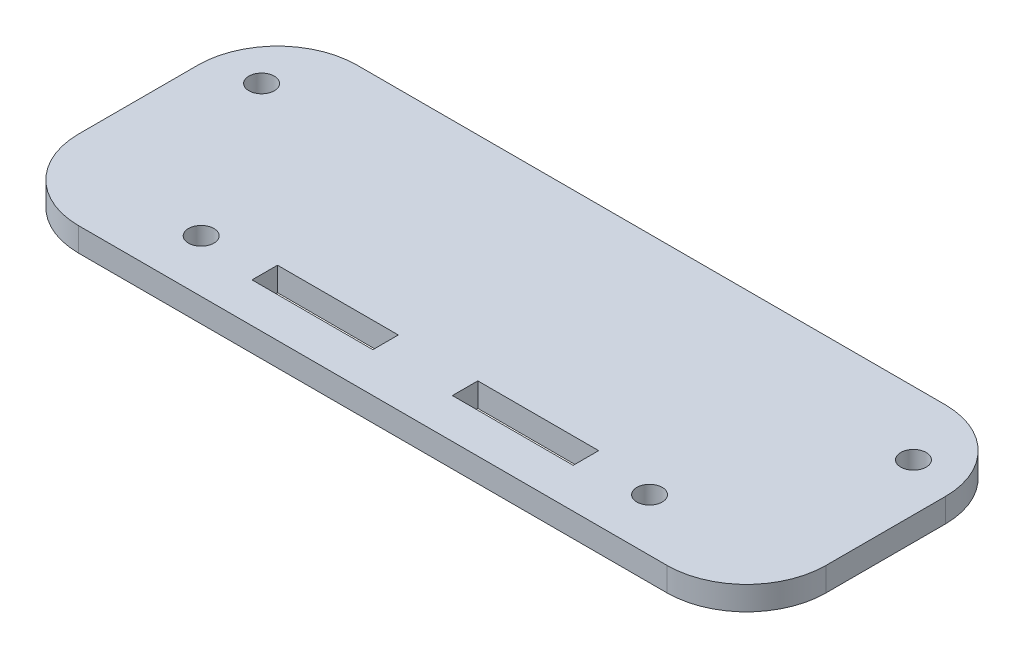
from build123d import *

# Parameters (mm, degrees)
SKETCH1_W           = 70
SKETCH1_H           = 109
SKETCH1_R           = 1.6
SKETCH1_W_2         = 15.2
SKETCH1_H_2         = 3.2
BOSS_EXTRUDE1_DEPTH = 3
SKETCH3_W           = 70
SKETCH3_H           = 74
SKETCH3_R           = 1.6
CUT_EXTRUDE1_DEPTH  = 130.576232389
SKETCH4_W           = 12
SKETCH4_H           = 35
SKETCH4_R           = 1.6
BOSS_EXTRUDE2_DEPTH = 3
FILLET3_R           = 10


with BuildPart() as part:
    # Sketch1 → Boss-Extrude1 (new body)
    with BuildSketch(Plane(origin=(0, 0, 0), x_dir=(1, 0, 0), z_dir=(0, 1, 0))):
        with Locations((35, 54.5)):
            Rectangle(SKETCH1_W, SKETCH1_H)
        with Locations(Location((6.8, 6.6, 0), (0, 0, 270))):
            Circle(SKETCH1_R, mode=Mode.SUBTRACT)
        with Locations(Location((63.2, 6.6, 0), (0, 0, 270))):
            Circle(SKETCH1_R, mode=Mode.SUBTRACT)
        with Locations(Location((6.8, 103, 0), (0, 0, 270))):
            Circle(SKETCH1_R, mode=Mode.SUBTRACT)
        with Locations(Location((63.2, 103, 0), (0, 0, 270))):
            Circle(SKETCH1_R, mode=Mode.SUBTRACT)
        with Locations((22.4, 6.6)):
            Rectangle(SKETCH1_W_2, SKETCH1_H_2, mode=Mode.SUBTRACT)
        with Locations((47.6, 6.6)):
            Rectangle(SKETCH1_W_2, SKETCH1_H_2, mode=Mode.SUBTRACT)
    extrude(amount=BOSS_EXTRUDE1_DEPTH)

    # Sketch3 → Cut-Extrude1 (cut, through all)
    with BuildSketch(Plane(origin=(0, 3, 0), x_dir=(1, 0, 0), z_dir=(0, 1, 0))):
        with Locations((35, 72)):
            Rectangle(SKETCH3_W, SKETCH3_H)
        with Locations((6.8, 103)):
            Circle(SKETCH3_R, mode=Mode.SUBTRACT)
        with Locations((63.2, 103)):
            Circle(SKETCH3_R, mode=Mode.SUBTRACT)
    extrude(amount=-CUT_EXTRUDE1_DEPTH, mode=Mode.SUBTRACT)

    # Sketch4 → Boss-Extrude2 (add)
    # profile 1 of 2: a face of its own
    with BuildSketch(Plane(origin=(0, 3, 0), x_dir=(1, 0, 0), z_dir=(0, 1, 0))):
        with Locations((76, 17.5)):
            Rectangle(SKETCH4_W, SKETCH4_H)
        with Locations(Location((76, 27, 0), (0, 0, 270))):
            Circle(SKETCH4_R, mode=Mode.SUBTRACT)
    # profile 2 of 2: a face of its own
    with BuildSketch(Plane(origin=(0, 3, 0), x_dir=(1, 0, 0), z_dir=(0, 1, 0))):
        with Locations((-6, 17.5)):
            Rectangle(SKETCH4_W, SKETCH4_H)
        with Locations(Location((-6, 27, 0), (0, 0, 270))):
            Circle(SKETCH4_R, mode=Mode.SUBTRACT)
    extrude(amount=-BOSS_EXTRUDE2_DEPTH)

    # Fillet3
    fillet3_edges = [part.edges().sort_by_distance(p)[0] for p in [
        (82, 1.5, -35),
        (82, 1.5, 0),
        (-12, 1.5, 0),
        (-12, 1.5, -35),
    ]]
    fillet(fillet3_edges, radius=FILLET3_R)


solid = part.part
